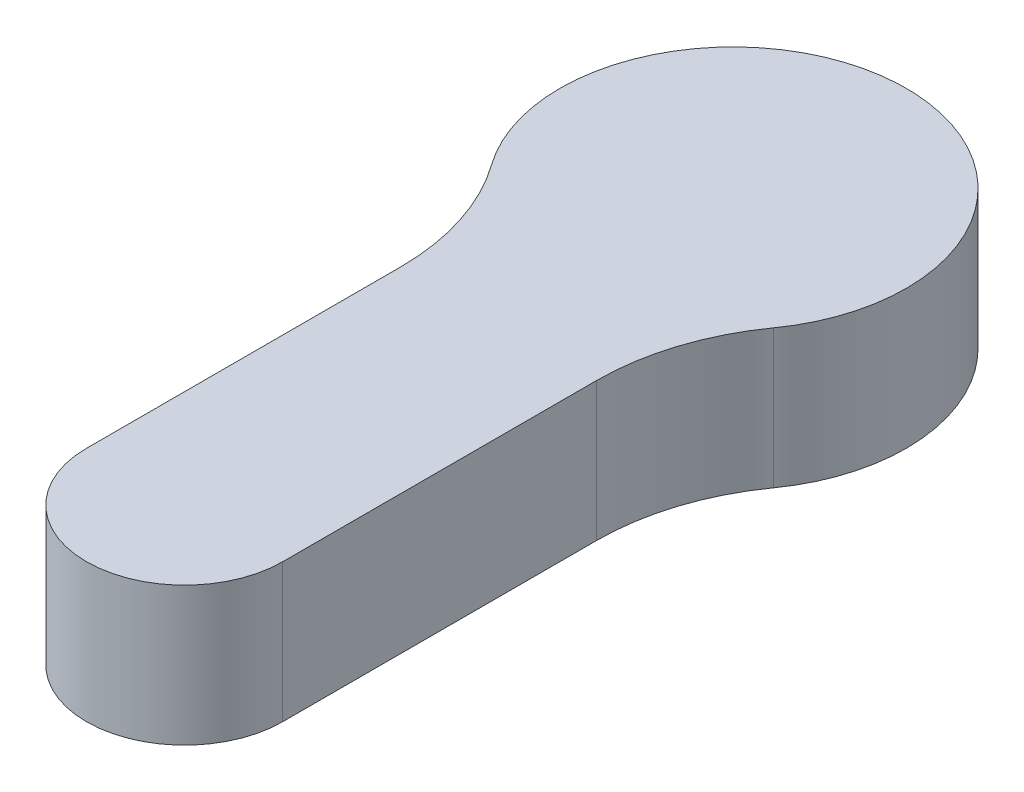
from build123d import *

# Parameters (mm, degrees)
SKETCH1_R           = 7.5
BOSS_EXTRUDE1_DEPTH = 6
FILLET1_R           = 10


with BuildPart() as part:
    # Sketch1 → Boss-Extrude1 (new body)
    with BuildSketch(Plane(origin=(0, 0, 0), x_dir=(1, 0, 0), z_dir=(0, 1, 0))):
        Circle(SKETCH1_R)
        with BuildLine():
            Line((-4.25, 0), (-4.25, -23.75))
            ThreePointArc((-4.25, -23.75), (0, -28), (4.25, -23.75))
            Line((4.25, -23.75), (4.25, 0))
            ThreePointArc((4.25, 0), (0, 4.25), (-4.25, 0))
        make_face()
    extrude(amount=BOSS_EXTRUDE1_DEPTH)

    # Fillet1
    fillet1_edges = [part.edges().sort_by_distance(p)[0] for p in [
        (4.25, 3, 6.179603547),
        (-4.25, 3, 6.179603547),
    ]]
    fillet(fillet1_edges, radius=FILLET1_R)


solid = part.part
